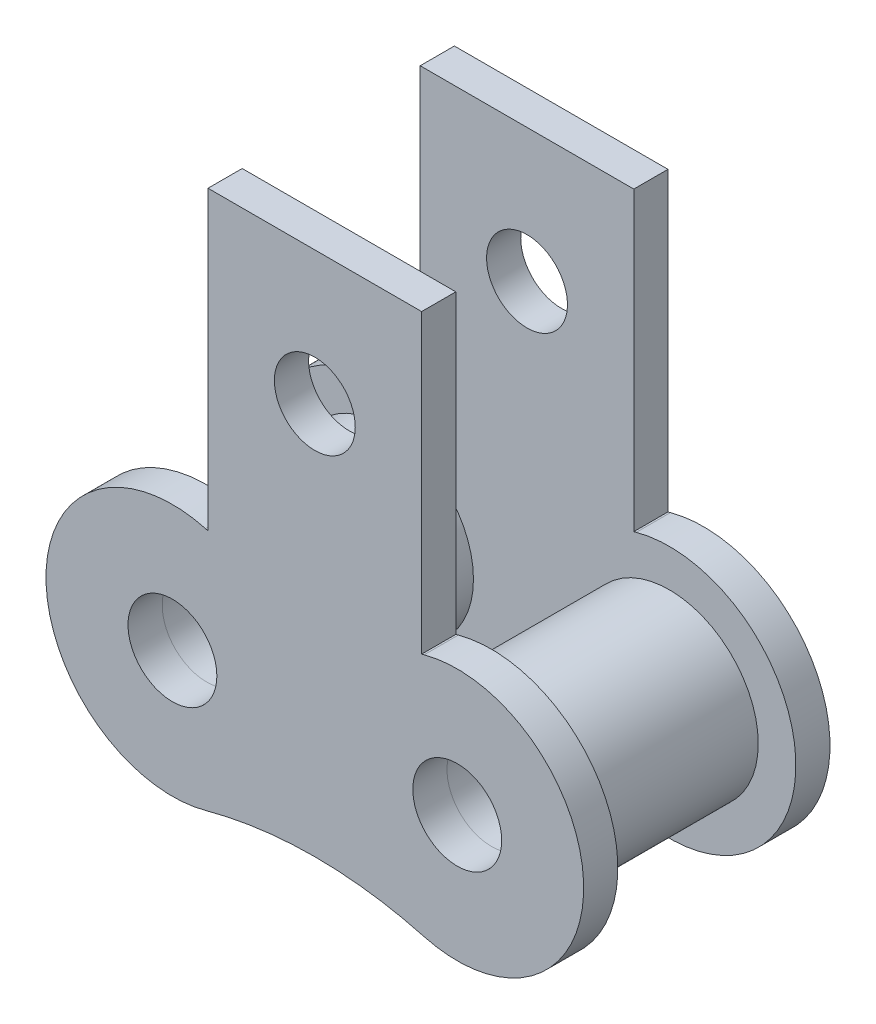
from build123d import *

# Parameters (mm, degrees)
SKETCH4_R           = 3.9624
SKETCH4_R_2         = 2.0066
BOSS_EXTRUDE1_DEPTH = 3.96875
SKETCH5_R           = 1.9812
BOSS_EXTRUDE2_DEPTH = 1.524
LPATTERN1_COUNT     = 2
LPATTERN1_PITCH     = 12.7
SKETCH7_R           = 1.9812
BOSS_EXTRUDE3_DEPTH = 1.524
SKETCH13_W          = 9.525
SKETCH13_H          = 13.85062
SKETCH13_R          = 1.8034
BOSS_EXTRUDE6_DEPTH = 1.524
SKETCH14_W          = 9.525
SKETCH14_H          = 13.85062
SKETCH14_R          = 1.8034
BOSS_EXTRUDE7_DEPTH = 1.524


with BuildPart() as part:
    # Sketch4 → Boss-Extrude1 (new, symmetric)
    with BuildSketch(Plane.XY):
        with Locations((6.35, 0)):
            Circle(SKETCH4_R)
        with Locations((6.35, 0)):
            Circle(SKETCH4_R_2, mode=Mode.SUBTRACT)
    extrude(amount=BOSS_EXTRUDE1_DEPTH, both=True)


with BuildPart() as body_2:
    # Sketch5 → Boss-Extrude2 (new body)
    with BuildSketch(Plane.XY.offset(3.96875)):
        with BuildLine():
            ThreePointArc((-4.874011031, 5.442198269), (-11.9888, 0), (-4.874011031, -5.442198269))
            ThreePointArc((-4.874011031, -5.442198269), (0, -4.79298), (4.874011031, -5.442198269))
            ThreePointArc((4.874011031, -5.442198269), (11.9888, 0), (4.874011031, 5.442198269))
            ThreePointArc((4.874011031, 5.442198269), (0, 4.79298), (-4.874011031, 5.442198269))
        make_face()
        with Locations((-6.35, 0)):
            Circle(SKETCH5_R, mode=Mode.SUBTRACT)
        with Locations((6.35, 0)):
            Circle(SKETCH5_R, mode=Mode.SUBTRACT)
    extrude(amount=BOSS_EXTRUDE2_DEPTH)

    # Sketch14 → Boss-Extrude7 (add)
    with BuildSketch(Plane(origin=(0, 0, 3.96875), x_dir=(-1, 0, 0), z_dir=(0, 0, -1))):
        with Locations((0, 11.71829)):
            Rectangle(SKETCH14_W, SKETCH14_H)
        with Locations((0, 12.7)):
            Circle(SKETCH14_R, mode=Mode.SUBTRACT)
    extrude(amount=-BOSS_EXTRUDE7_DEPTH)


with BuildPart() as lpattern1_1:
    # LPattern1: pattern copy
    add(part.part.moved(Location(Vector(-1, 0, 0) * (1 * LPATTERN1_PITCH))))


with BuildPart() as body_4:
    # Sketch7 → Boss-Extrude3 (new body)
    with BuildSketch(Plane.XY.offset(-3.96875)):
        with BuildLine():
            ThreePointArc((4.874011031, -5.442198269), (11.9888, 0), (4.874011031, 5.442198269))
            ThreePointArc((4.874011031, 5.442198269), (0, 4.79298), (-4.874011031, 5.442198269))
            ThreePointArc((-4.874011031, 5.442198269), (-11.9888, 0), (-4.874011031, -5.442198269))
            ThreePointArc((-4.874011031, -5.442198269), (0, -4.79298), (4.874011031, -5.442198269))
        make_face()
        with Locations((6.35, 0)):
            Circle(SKETCH7_R, mode=Mode.SUBTRACT)
        with Locations((-6.35, 0)):
            Circle(SKETCH7_R, mode=Mode.SUBTRACT)
    extrude(amount=-BOSS_EXTRUDE3_DEPTH)

    # Sketch13 → Boss-Extrude6 (add)
    with BuildSketch(Plane(origin=(0, 17.1069, -5.49275), x_dir=(-1, 0, 0), z_dir=(0, 0, -1))):
        with Locations((0, -5.38861)):
            Rectangle(SKETCH13_W, SKETCH13_H)
        with Locations((0, -4.4069)):
            Circle(SKETCH13_R, mode=Mode.SUBTRACT)
    extrude(amount=-BOSS_EXTRUDE6_DEPTH)


solid = Compound([part.part, body_2.part, lpattern1_1.part, body_4.part])
